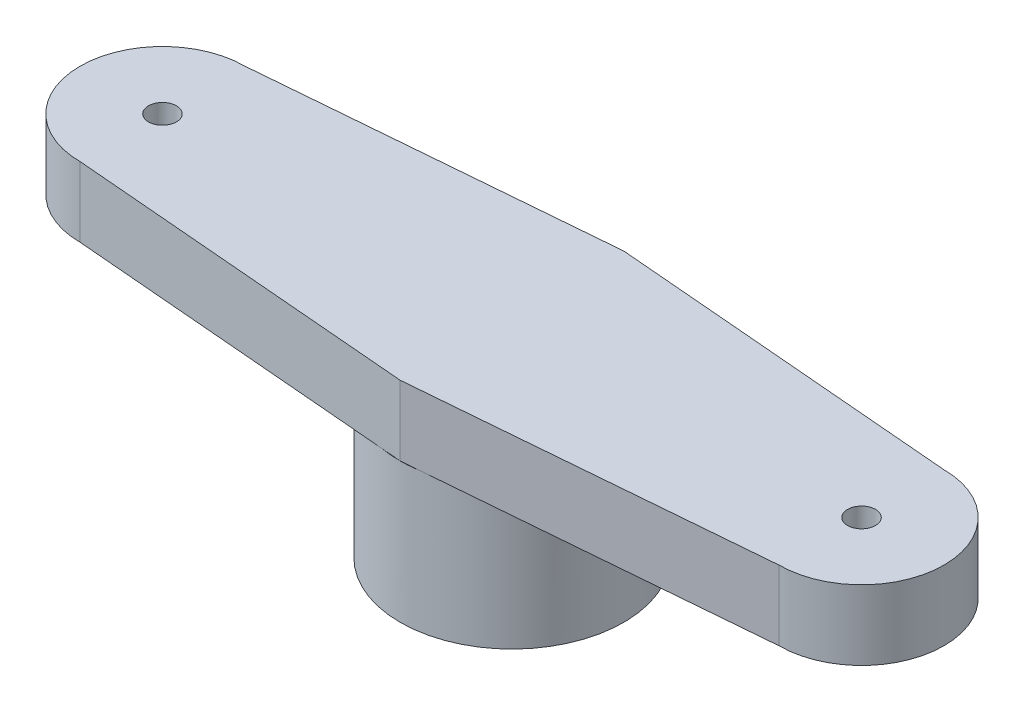
from build123d import *

# Parameters (mm, degrees)
SKETCH2_R           = 8
SKETCH2_R_2         = 5.25
BOSS_EXTRUDE1_DEPTH = 10
BOSS_EXTRUDE2_DEPTH = 5
SKETCH4_R           = 1
CUT_EXTRUDE1_DEPTH  = 5


with BuildPart() as part:
    # Sketch2 → Boss-Extrude1 (new body)
    with BuildSketch(Plane(origin=(0, 0, 0), x_dir=(1, 0, 0), z_dir=(0, 1, 0))):
        with Locations(Location((0, 0, 0), (0, 0, 270))):
            Circle(SKETCH2_R)
        with Locations(Location((0, 0, 0), (0, 0, 270))):
            Circle(SKETCH2_R_2, mode=Mode.SUBTRACT)
    extrude(amount=BOSS_EXTRUDE1_DEPTH)

    # Sketch3 → Boss-Extrude2 (add)
    with BuildSketch(Plane(origin=(0, 10, 0), x_dir=(1, 0, 0), z_dir=(0, 1, 0))):
        with BuildLine():
            Line((0, 8), (-25, 5.901469298))
            ThreePointArc((-25, 5.901469298), (-30.901469298, 0), (-25, -5.901469298))
            Line((-25, -5.901469298), (0, -8))
            Line((0, -8), (25, -5.901469298))
            ThreePointArc((25, -5.901469298), (30.901469298, 0), (25, 5.901469298))
            Line((25, 5.901469298), (0, 8))
        make_face()
    extrude(amount=BOSS_EXTRUDE2_DEPTH)

    # Sketch4 → Cut-Extrude1 (cut)
    with BuildSketch(Plane(origin=(0, 15, 0), x_dir=(1, 0, 0), z_dir=(0, 1, 0))):
        with Locations(Location((-25, 0, 0), (0, 0, 270))):
            Circle(SKETCH4_R)
        with Locations(Location((25, 0, 0), (0, 0, 270))):
            Circle(SKETCH4_R)
    extrude(amount=-CUT_EXTRUDE1_DEPTH, mode=Mode.SUBTRACT)


solid = part.part
